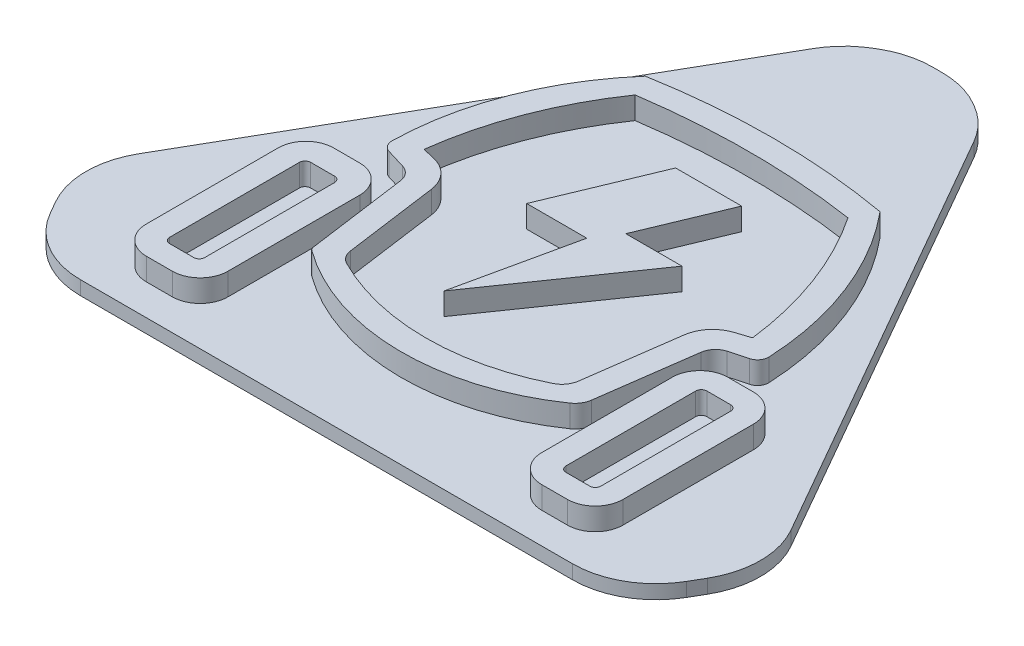
from build123d import *

# Parameters (mm, degrees)
SALIENTE_EXTRUIR1_DEPTH   = 4
SALIENTE_EXTRUIR1_2_DEPTH = 4
SALIENTE_EXTRUIR1_3_DEPTH = 4
SALIENTE_EXTRUIR1_4_DEPTH = 4
SALIENTE_EXTRUIR4_DEPTH   = 2.5


with BuildPart() as part:
    # Croquis1 → Saliente-Extruir1 (new body)
    with BuildSketch(Plane(origin=(0, 0, 0), x_dir=(1, 0, 0), z_dir=(0, 1, 0))):
        with BuildLine():
            ThreePointArc((24.735317162, -10.364213377), (24.248592978, -11.720458271), (23.256713943, -12.765674337))
            ThreePointArc((23.256713943, -12.765674337), (-0.301443486, -19.95898411), (-23.6872801, -12.223796151))
            ThreePointArc((-23.6872801, -12.223796151), (-23.957956222, -11.928413602), (-24.090963646, -11.550491071))
            Line((-24.090963646, -11.550491071), (-26.593504351, 6.639690423))
            ThreePointArc((-26.593504351, 6.639690423), (-27.283319128, 8.17801652), (-28.693873074, 9.101395733))
            Line((-28.693873074, 9.101395733), (-32.150547194, 10.150996156))
            ThreePointArc((-32.150547194, 10.150996156), (-33.187437723, 10.889076251), (-33.569084317, 12.103263251))
            ThreePointArc((-33.569084317, 12.103263251), (-30.118383627, 29.630783624), (-20.863266874, 44.910316325))
            ThreePointArc((-20.863266874, 44.910316325), (0.239054347, 46.767665402), (21.341375569, 44.910316325))
            ThreePointArc((21.341375569, 44.910316325), (30.311360731, 29.654768569), (33.971770868, 12.340214899))
            ThreePointArc((33.971770868, 12.340214899), (33.591964571, 11.071163494), (32.502360075, 10.317833331))
            Line((32.502360075, 10.317833331), (29.306873174, 9.442473887))
            ThreePointArc((29.306873174, 9.442473887), (27.844705893, 8.527958517), (27.127684399, 6.959471444))
            Line((27.127684399, 6.959471444), (24.735317162, -10.364213377))
        make_face()
        with BuildLine():
            Line((20.603314318, -8.570902391), (22.906419095, 8.106412307))
            ThreePointArc((22.906419095, 8.106412307), (24.243847943, 11.130514009), (26.980259101, 12.986843989))
            Line((26.980259101, 12.986843989), (29.51197218, 13.81713433))
            ThreePointArc((29.51197218, 13.81713433), (26.070313597, 28.043115781), (19.407293404, 41.074912432))
            ThreePointArc((19.407293404, 41.074912432), (0.273848763, 42.495848638), (-18.859595878, 41.074912432))
            ThreePointArc((-18.859595878, 41.074912432), (-25.76543723, 27.985894011), (-29.361445326, 13.630345475))
            Line((-29.361445326, 13.630345475), (-27.064825612, 13.093562644))
            ThreePointArc((-27.064825612, 13.093562644), (-23.995371379, 11.292144095), (-22.48638433, 8.068851342))
            Line((-22.48638433, 8.068851342), (-20.161283591, -8.830099253))
            ThreePointArc((-20.161283591, -8.830099253), (-19.632507369, -10.162063132), (-18.546205688, -11.096772031))
            ThreePointArc((-18.546205688, -11.096772031), (0.060689408, -15.579037847), (18.697865881, -11.224396063))
            ThreePointArc((18.697865881, -11.224396063), (19.979160972, -10.133592829), (20.603314318, -8.570902391))
        make_face(mode=Mode.SUBTRACT)
    extrude(amount=SALIENTE_EXTRUIR1_DEPTH)



with BuildPart() as body_2:
    # Croquis1 → Saliente-Extruir1 2 (new body)
    with BuildSketch(Plane(origin=(0, 0, 0), x_dir=(1, 0, 0), z_dir=(0, 1, 0))):
        Polygon((-11.705967947, 14.426136366), (-0.899048263, 14.426136366), (-5.508070268, -6.59896119), (12.002660496, 18.633842358), (1.904898556, 18.633842358), (8.015220238, 33.347588292), (-3.8482709, 33.347588292), align=None)
    extrude(amount=SALIENTE_EXTRUIR1_2_DEPTH)


with BuildPart() as body_3:
    # Croquis1 → Saliente-Extruir1 3 (new body)
    with BuildSketch(Plane(origin=(0, 0, 0), x_dir=(1, 0, 0), z_dir=(0, 1, 0))):
        with BuildLine():
            Line((-33.018215507, -27.970809887), (-37.703834023, -27.970809887))
            ThreePointArc((-37.703834023, -27.970809887), (-41.239367929, -26.506343793), (-42.703834023, -22.970809887))
            Line((-42.703834023, -22.970809887), (-42.703834023, 0.725352507))
            ThreePointArc((-42.703834023, 0.725352507), (-41.239367929, 4.260886413), (-37.703834023, 5.725352507))
            Line((-37.703834023, 5.725352507), (-33.018215507, 5.725352507))
            ThreePointArc((-33.018215507, 5.725352507), (-29.482681601, 4.260886413), (-28.018215507, 0.725352507))
            Line((-28.018215507, 0.725352507), (-28.018215507, -22.970809887))
            ThreePointArc((-28.018215507, -22.970809887), (-29.482681601, -26.506343793), (-33.018215507, -27.970809887))
        make_face()
        with BuildLine():
            ThreePointArc((-33.230214616, -23.921699906), (-32.523107835, -23.628806688), (-32.230214616, -22.921699906))
            Line((-32.230214616, -22.921699906), (-32.230214616, 0.414545051))
            ThreePointArc((-32.230214616, 0.414545051), (-32.523107835, 1.121651832), (-33.230214616, 1.414545051))
            Line((-33.230214616, 1.414545051), (-37.542643739, 1.414545051))
            ThreePointArc((-37.542643739, 1.414545051), (-38.24975052, 1.121651832), (-38.542643739, 0.414545051))
            Line((-38.542643739, 0.414545051), (-38.542643739, -22.921699906))
            ThreePointArc((-38.542643739, -22.921699906), (-38.24975052, -23.628806688), (-37.542643739, -23.921699906))
            Line((-37.542643739, -23.921699906), (-33.230214616, -23.921699906))
        make_face(mode=Mode.SUBTRACT)
    extrude(amount=SALIENTE_EXTRUIR1_3_DEPTH)


with BuildPart() as body_4:
    # Croquis1 → Saliente-Extruir1 4 (new body)
    with BuildSketch(Plane(origin=(0, 0, 0), x_dir=(1, 0, 0), z_dir=(0, 1, 0))):
        with BuildLine():
            Line((43.03056828, -22.990060864), (43.03056828, 0.457791938))
            ThreePointArc((43.03056828, 0.457791938), (41.566102186, 3.993325844), (38.03056828, 5.457791938))
            Line((38.03056828, 5.457791938), (33.431492806, 5.457791938))
            ThreePointArc((33.431492806, 5.457791938), (29.8959589, 3.993325844), (28.431492806, 0.457791938))
            Line((28.431492806, 0.457791938), (28.431492806, -22.990060864))
            ThreePointArc((28.431492806, -22.990060864), (29.8959589, -26.52559477), (33.431492806, -27.990060864))
            Line((33.431492806, -27.990060864), (38.03056828, -27.990060864))
            ThreePointArc((38.03056828, -27.990060864), (41.566102186, -26.52559477), (43.03056828, -22.990060864))
        make_face()
        with BuildLine():
            Line((32.681003043, -22.909445085), (32.681003043, 0.429273953))
            ThreePointArc((32.681003043, 0.429273953), (32.973896262, 1.136380734), (33.681003043, 1.429273953))
            Line((33.681003043, 1.429273953), (37.969534376, 1.429273953))
            ThreePointArc((37.969534376, 1.429273953), (38.676641157, 1.136380734), (38.969534376, 0.429273953))
            Line((38.969534376, 0.429273953), (38.969534376, -22.909445085))
            ThreePointArc((38.969534376, -22.909445085), (38.676641157, -23.616551866), (37.969534376, -23.909445085))
            Line((37.969534376, -23.909445085), (33.681003043, -23.909445085))
            ThreePointArc((33.681003043, -23.909445085), (32.973896262, -23.616551866), (32.681003043, -22.909445085))
        make_face(mode=Mode.SUBTRACT)
    extrude(amount=SALIENTE_EXTRUIR1_4_DEPTH)


with BuildPart() as part_1:
    add(part.part)

    add(body_2.part)  # Saliente-Extruir4 merges body 2

    add(body_3.part)  # Saliente-Extruir4 merges body 3

    add(body_4.part)  # Saliente-Extruir4 merges body 4
    # Croquis4 → Saliente-Extruir4 (add)
    with BuildSketch(Plane.XZ):
        with BuildLine():
            Line((-43.946678981, 33.550376808), (44.509741085, 33.550376808))
            ThreePointArc((44.509741085, 33.550376808), (51.998021732, 31.547516992), (57.486572192, 26.073797202))
            Line((57.486572192, 26.073797202), (58.879911857, 23.670484273))
            ThreePointArc((58.879911857, 23.670484273), (60.903025841, 16.187650298), (58.920434856, 8.693977802))
            Line((58.920434856, 8.693977802), (14.830934948, -68.31152391))
            ThreePointArc((14.830934948, -68.31152391), (12.450857587, -71.434275551), (9.341944939, -73.83240153))
            Line((9.341944939, -73.83240153), (8.830099524, -74.129408577))
            ThreePointArc((8.830099524, -74.129408577), (5.205365249, -75.63859627), (1.313165605, -76.155440525))
            Line((1.313165605, -76.155440525), (-0.526820951, -76.156842617))
            ThreePointArc((-0.526820951, -76.156842617), (-4.419803759, -75.645930765), (-8.046833861, -74.142269004))
            Line((-8.046833861, -74.142269004), (-8.559131327, -73.846042366))
            ThreePointArc((-8.559131327, -73.846042366), (-11.671695164, -71.452657228), (-14.056528907, -68.333536506))
            Line((-14.056528907, -68.333536506), (-58.32332823, 8.709094133))
            ThreePointArc((-58.32332823, 8.709094133), (-60.317329602, 16.205451495), (-58.299908193, 23.695540015))
            Line((-58.299908193, 23.695540015), (-56.929239256, 26.063906519))
            ThreePointArc((-56.929239256, 26.063906519), (-51.439911073, 31.544662969), (-43.946678981, 33.550376808))
        make_face()
    extrude(amount=SALIENTE_EXTRUIR4_DEPTH)


solid = part_1.part
